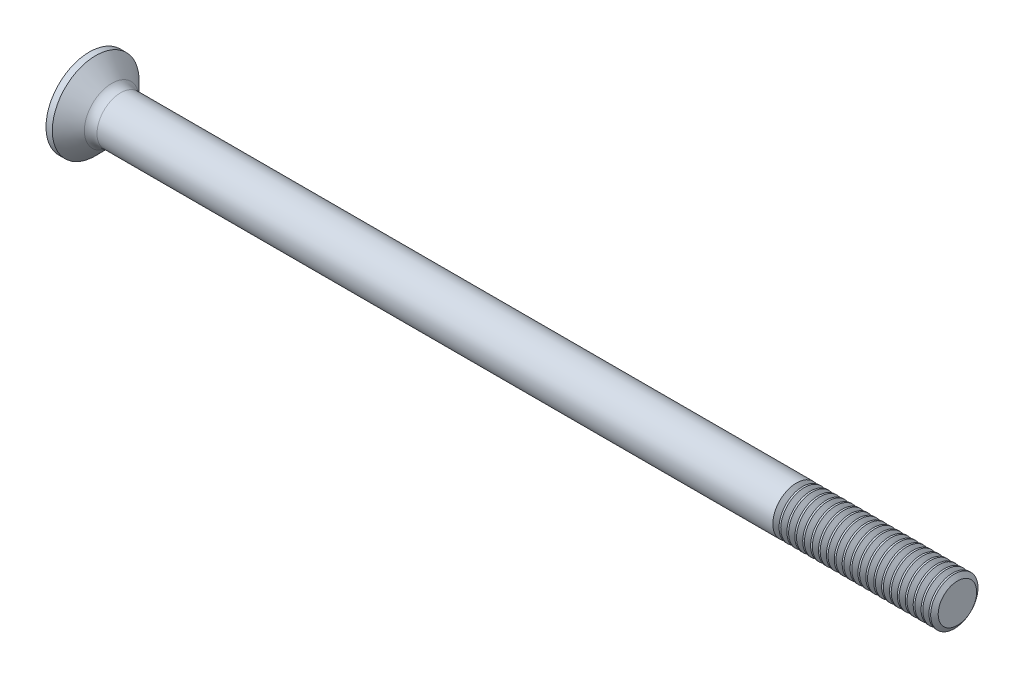
from build123d import *

# Parameters (mm, degrees)
FILLET1_R       = 0.8
RECPAT_COUNT    = 2
RECPAT_ANGLE    = 90
THDSCHPAT_COUNT = 21
THDSCHPAT_PITCH = 0.5


with BuildPart() as part:
    # BodySke → Base-Revolve (revolve)
    with BuildSketch(Plane.XY, mode=Mode.PRIVATE) as base_revolve_sk:
        Polygon((0, 0), (0, 2.75), (0.4, 2.75), (1.65, 1.5), (55, 1.5), (55, 0), align=None)
    revolve(base_revolve_sk.sketch.rotate(Axis((-6.35, 0, 0), (1, 0, 0)), 90), axis=Axis((-6.35, 0, 0), (1, 0, 0)))

    # Fillet1
    fillet1_edges = [part.edges().sort_by_distance(p)[0] for p in [
        (1.65, 0, -1.5),
    ]]
    fillet(fillet1_edges, radius=FILLET1_R)

    # Sketch3 → Recess section 0
    with BuildSketch(Plane.ZY):
        with BuildLine():
            Line((-0.37, 1.5), (0.37, 1.5))
            Line((0.37, 1.5), (0.37, -1.5))
            Line((0.37, -1.5), (-0.37, -1.5))
            Line((-0.37, -1.5), (-0.37, 1.5))
        make_face()
    # Sketch4 → Recess section 1
    with BuildSketch(Plane.ZY.offset(-2.01)):
        with BuildLine():
            Line((-0.37, 0.497851002), (0.37, 0.497851002))
            Line((0.37, 0.497851002), (0.37, -0.497851002))
            Line((0.37, -0.497851002), (-0.37, -0.497851002))
            Line((-0.37, -0.497851002), (-0.37, 0.497851002))
        make_face()
    recess = loft(mode=Mode.SUBTRACT)

    # RecPat: Recess ×2 about axis
    recpat_axis = Axis((0, 0, 0), (1, 0, 0))
    for i in range(1, RECPAT_COUNT):
        add(recess.rotate(recpat_axis, i * RECPAT_ANGLE / (RECPAT_COUNT - 1)), mode=Mode.SUBTRACT)

    # RecCorSke → RecessCore (revolve, cut)
    with BuildSketch(Plane.XY, mode=Mode.PRIVATE) as recesscore_sk:
        Polygon((0, 0), (0, 0.696552892), (2.01, 0.556), (2.190655351, 0), align=None)
    revolve(recesscore_sk.sketch.rotate(Axis((-3.175, 0, 0), (1, 0, 0)), 90), axis=Axis((-3.175, 0, 0), (1, 0, 0)), mode=Mode.SUBTRACT)

    # ThdSchSke → ThreadSchematic (revolve, cut)
    with BuildSketch(Plane.XY, mode=Mode.PRIVATE) as threadschematic_sk:
        Polygon((45.000001, -1.2195), (44.803592786, -1.5), (44.803592786, -1.875), (45.196409214, -1.875), (45.196409214, -1.5), align=None)
    threadschematic = revolve(threadschematic_sk.sketch.rotate(Axis((-3.175, 0, 0), (1, 0, 0)), 270), axis=Axis((-3.175, 0, 0), (1, 0, 0)), mode=Mode.SUBTRACT)

    # ThdSchPat: ThreadSchematic ×21
    with Locations(*[(i * THDSCHPAT_PITCH, 0, 0) for i in range(1, THDSCHPAT_COUNT)]):
        add(threadschematic, mode=Mode.SUBTRACT)


solid = part.part
